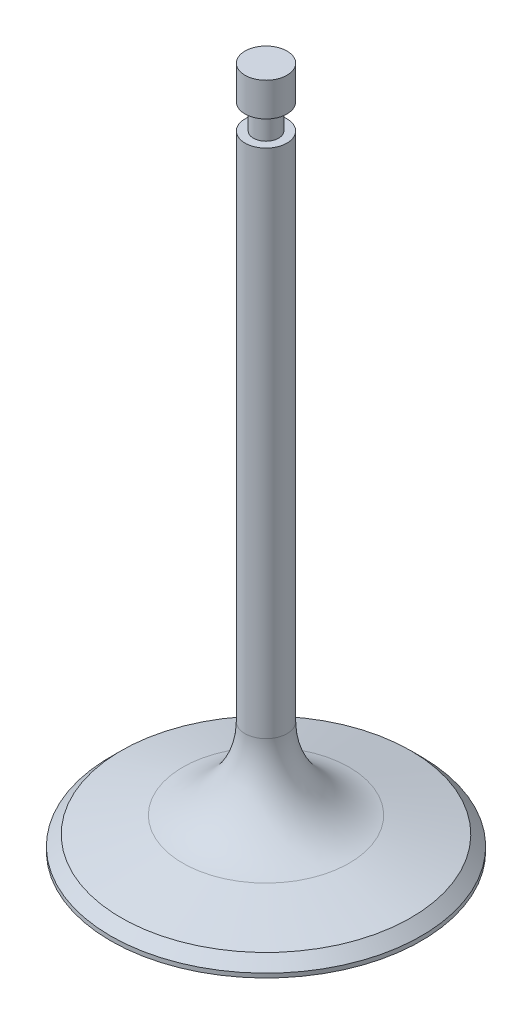
from build123d import *


with BuildPart() as part:
    # Sketch1 → Revolve1 (revolve)
    with BuildSketch(Plane(origin=(0, 0, 0), x_dir=(0, 0, -1), z_dir=(1, 0, 0))):
        with BuildLine():
            Line((0, 0), (0, 82.79))
            Line((0, 82.79), (2.5, 82.79))
            Line((2.5, 82.79), (2.5, 78.79))
            Line((2.5, 78.79), (1.5, 78.79))
            Line((1.5, 78.79), (1.5, 75.79))
            Line((1.5, 75.79), (2.5, 75.79))
            Line((2.5, 75.79), (2.5, 14.875520468))
            ThreePointArc((2.5, 14.875520468), (4.566466597, 8.787906178), (9.911809549, 5.216262205))
            Line((9.911809549, 5.216262205), (17.25, 3.25))
            Line((17.25, 3.25), (18.5, 2))
            Line((18.5, 2), (18.5, 1.5))
            ThreePointArc((18.5, 1.5), (9.280355597, 0.375614308), (0, 0))
        make_face()
    revolve(axis=Axis((0, 0, 0), (0, 1, 0)))


solid = part.part
